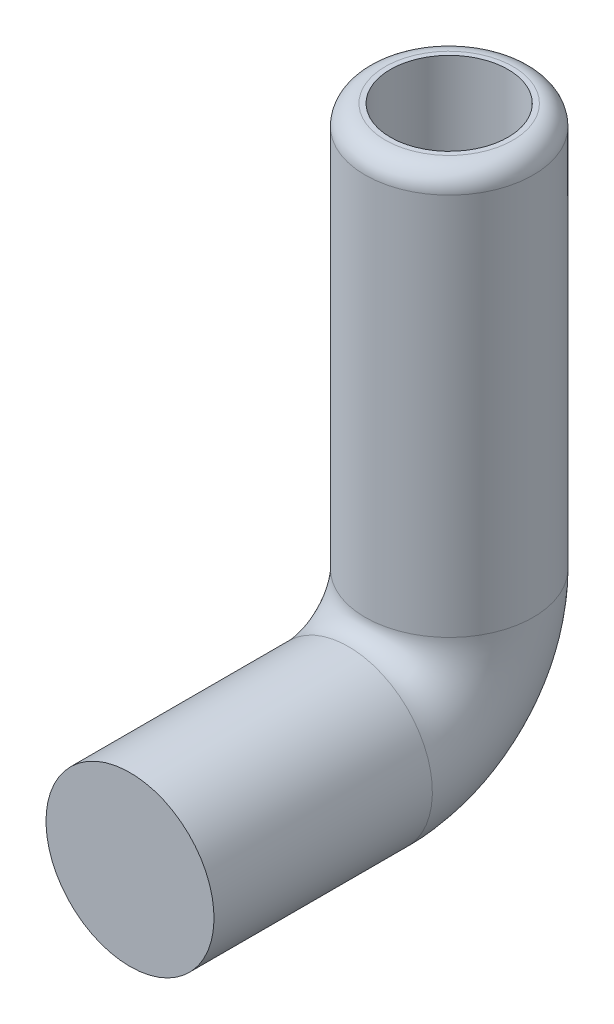
from build123d import *

# Parameters (mm, degrees)
SWEEP1_PROFILE_R    = 25
BOSS_EXTRUDE2_START = 30
SKETCH32_R          = 25
SKETCH32_R_2        = 17.5
BOSS_EXTRUDE2_DEPTH = 30
FILLET1_R           = 6
SKETCH33_R          = 17.5
CUT_EXTRUDE1_DEPTH  = 80


with BuildPart() as part:
    # Sweep1: sweep along a path in Sketch2
    with BuildLine(Plane(origin=(0, 0, 0), x_dir=(0, 0, -1), z_dir=(1, 0, 0))) as sweep1_path:
        Line((-65, 0), (0, 0))
        ThreePointArc((0, 0), (21.213203436, 8.786796564), (30, 30))
        Line((30, 30), (30, 120))
    # Sweep1 profile (on start of the path) → Sweep1 (sweep)
    with BuildSketch(Plane(origin=(0, 0, 65), x_dir=(-1, 0, 0), z_dir=(0, 0, -1))):
        Circle(SWEEP1_PROFILE_R)
    sweep(path=sweep1_path.line)

    # Sketch32 → Boss-Extrude2 (add)
    with BuildSketch(Plane(origin=(0, 120, 0), x_dir=(1, 0, 0), z_dir=(0, 1, 0)).offset(BOSS_EXTRUDE2_START)):
        with Locations(Location((0, 30, 0), (0, 0, 270))):
            Circle(SKETCH32_R)
        with Locations(Location((0, 30, 0), (0, 0, 270))):
            Circle(SKETCH32_R_2, mode=Mode.SUBTRACT)
    extrude(amount=-BOSS_EXTRUDE2_DEPTH)

    # Fillet1
    fillet1_edges = [part.edges().sort_by_distance(p)[0] for p in [
        (0, 150, -55),
    ]]
    fillet(fillet1_edges, radius=FILLET1_R)

    # Sketch33 → Cut-Extrude1 (cut)
    with BuildSketch(Plane(origin=(0, 120, 0), x_dir=(1, 0, 0), z_dir=(0, 1, 0))):
        with Locations(Location((0, 30, 0), (0, 0, 270))):
            Circle(SKETCH33_R)
    extrude(amount=-CUT_EXTRUDE1_DEPTH, mode=Mode.SUBTRACT)


solid = part.part
